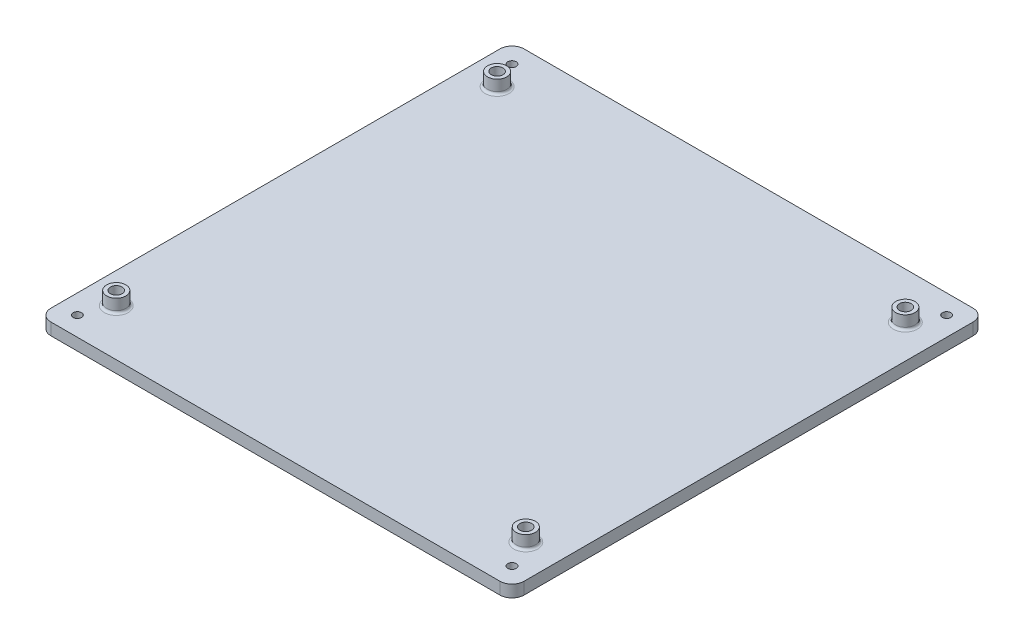
from build123d import *

# Parameters (mm, degrees)
SKETCH1_W           = 197
SKETCH1_H           = 197
BOSS_EXTRUDE1_DEPTH = 5
SKETCH2_R           = 1.75
CUT_EXTRUDE1_DEPTH  = 5
FILLET1_R           = 5
SKETCH5_R           = 4
SKETCH5_R_2         = 2.45
BOSS_EXTRUDE2_DEPTH = 5.5
FILLET2_R           = 1
CUT_EXTRUDE2_DEPTH  = 3
CUT_EXTRUDE4_DEPTH  = 3


with BuildPart() as part:
    # Sketch1 → Boss-Extrude1 (new body)
    with BuildSketch(Plane(origin=(0, 0, 0), x_dir=(1, 0, 0), z_dir=(0, 1, 0))):
        Rectangle(SKETCH1_W, SKETCH1_H)
    extrude(amount=BOSS_EXTRUDE1_DEPTH)

    # Sketch2 → Cut-Extrude1 (cut)
    with BuildSketch(Plane(origin=(0, 0, 0), x_dir=(1, 0, 0), z_dir=(0, 1, 0))):
        with Locations(Location((-90.5, 90.5, 0), (0, 0, 270))):
            Circle(SKETCH2_R)
        with Locations(Location((90.5, 90.5, 0), (0, 0, 90))):
            Circle(SKETCH2_R)
        with Locations(Location((90.5, -90.5, 0), (0, 0, 270))):
            Circle(SKETCH2_R)
        with Locations(Location((-90.5, -90.5, 0), (0, 0, 90))):
            Circle(SKETCH2_R)
    extrude(amount=CUT_EXTRUDE1_DEPTH, mode=Mode.SUBTRACT)

    # Fillet1
    fillet1_edges = [part.edges().sort_by_distance(p)[0] for p in [
        (-98.5, 2.5, -98.5),
        (98.5, 2.5, -98.5),
        (98.5, 2.5, 98.5),
        (-98.5, 2.5, 98.5),
    ]]
    fillet(fillet1_edges, radius=FILLET1_R)

    # Sketch5 → Boss-Extrude2 (add)
    # profile 1 of 4: a face of its own
    with BuildSketch(Plane(origin=(0, 5, 0), x_dir=(1, 0, 0), z_dir=(0, 1, 0))):
        with Locations(Location((84.5, 79.3, 0), (0, 0, 270))):
            Circle(SKETCH5_R)
        with Locations(Location((84.5, 79.3, 0), (0, 0, 270))):
            Circle(SKETCH5_R_2, mode=Mode.SUBTRACT)
    # profile 2 of 4: a face of its own
    with BuildSketch(Plane(origin=(0, 5, 0), x_dir=(1, 0, 0), z_dir=(0, 1, 0))):
        with Locations(Location((84.75, -79, 0), (0, 0, 270))):
            Circle(SKETCH5_R)
        with Locations(Location((84.75, -79, 0), (0, 0, 270))):
            Circle(SKETCH5_R_2, mode=Mode.SUBTRACT)
    # profile 3 of 4: a face of its own
    with BuildSketch(Plane(origin=(0, 5, 0), x_dir=(1, 0, 0), z_dir=(0, 1, 0))):
        with Locations(Location((-85.8, -79, 0), (0, 0, 270))):
            Circle(SKETCH5_R)
        with Locations(Location((-85.8, -79, 0), (0, 0, 270))):
            Circle(SKETCH5_R_2, mode=Mode.SUBTRACT)
    # profile 4 of 4: a face of its own
    with BuildSketch(Plane(origin=(0, 5, 0), x_dir=(1, 0, 0), z_dir=(0, 1, 0))):
        with Locations(Location((-85.5, 79.3, 0), (0, 0, 270))):
            Circle(SKETCH5_R)
        with Locations(Location((-85.5, 79.3, 0), (0, 0, 270))):
            Circle(SKETCH5_R_2, mode=Mode.SUBTRACT)
    extrude(amount=BOSS_EXTRUDE2_DEPTH)

    # Fillet2
    fillet2_edges = [part.edges().sort_by_distance(p)[0] for p in [
        (84.5, 5, -83.3),
        (84.75, 5, 75),
        (-85.8, 5, 75),
        (-85.5, 5, -83.3),
    ]]
    fillet(fillet2_edges, radius=FILLET2_R)

    # Sketch6 → Cut-Extrude2 (cut)
    # profile 1 of 14: a face of its own
    with BuildSketch(Plane(origin=(0, 0, 0), x_dir=(1, 0, 0), z_dir=(0, 1, 0))):
        with BuildLine():
            Line((69.398642149, 13.074504186), (67.395437021, 13.074504186))
            add(Edge.make_bspline(
                [(67.395437021, 13.074504186), (67.264550196, 13.073918309), (67.012042076, 13.072788029), (66.647904593, 13.059081879), (66.311969935, 13.034519624), (66.004315284, 13.004164562), (65.725067139, 12.961607945), (65.473875798, 12.912820116), (65.250689132, 12.853382341), (65.05299038, 12.782830525), (64.875562137, 12.699652691), (64.707657792, 12.611062361), (64.553072004, 12.505332926), (64.40400236, 12.393859456), (64.268971428, 12.265992934), (64.139555172, 12.130243061), (64.021234722, 11.98122611), (63.913461826, 11.820745891), (63.815695203, 11.651767392), (63.73027974, 11.473988529), (63.6609955, 11.287127986), (63.602874638, 11.092394539), (63.556191395, 10.889796674), (63.525117543, 10.678088396), (63.504010619, 10.458747933), (63.502148224, 10.309464676), (63.501206251, 10.233959314)],
                knots=[0, 0, 0, 0, 1.698747864, 3.27724071, 4.728299578, 6.070144658, 7.288476769, 8.393259625, 9.389771311, 10.283485332, 11.113357557, 11.931608583, 12.74405601, 13.541433047, 14.344816069, 15.154114104, 15.974336324, 16.810834471, 17.661136416, 18.50621059, 19.367396281, 20.244825668, 21.142564693, 22.063065223, 23.020325768, 24, 24, 24, 24], degree=3))
            add(Edge.make_bspline(
                [(63.501206251, 10.233959314), (63.502569168, 10.150429531), (63.505247467, 9.986283241), (63.531503428, 9.745664919), (63.576356905, 9.516257135), (63.634978053, 9.29612525), (63.716721074, 9.088890924), (63.810108638, 8.88960948), (63.925004964, 8.70386816), (64.056292383, 8.529343563), (64.199673223, 8.364616721), (64.358551339, 8.21444381), (64.529898444, 8.077801108), (64.712722673, 7.953256588), (64.907710403, 7.841061483), (65.114720939, 7.740165207), (65.335167867, 7.653794734), (65.488680476, 7.608623676), (65.566510738, 7.585722135)],
                knots=[0, 0, 0, 0, 1.102006807, 2.165578795, 3.188629044, 4.184801286, 5.166646146, 6.124351954, 7.085497154, 8.042432466, 9.003981491, 9.963833307, 10.922997304, 11.89326795, 12.880200226, 13.889073926, 14.929769137, 16, 16, 16, 16], degree=3))
            add(Edge.make_bspline(
                [(65.566510738, 7.585722135), (65.617774227, 7.572967696), (65.72882745, 7.545337474), (65.912590033, 7.517285864), (66.124357115, 7.491494134), (66.364813478, 7.469329264), (66.634097752, 7.454262317), (66.931949197, 7.442495701), (67.258502797, 7.433940156), (67.485575257, 7.433636568), (67.603770354, 7.433478545)],
                knots=[0, 0, 0, 0, 0.618981996, 1.340914327, 2.176866532, 3.120127938, 4.170906482, 5.338178032, 6.614476169, 8, 8, 8, 8], degree=3))
            Line((67.603770354, 7.433478545), (67.603770354, 3.074504186))
            Line((67.603770354, 3.074504186), (69.398642149, 3.074504186))
            Line((69.398642149, 3.074504186), (69.398642149, 13.074504186))
        make_face()
        with BuildLine():
            Line((67.603770354, 9.22835034), (66.968754328, 9.22835034))
            add(Edge.make_bspline(
                [(66.968754328, 9.22835034), (66.853203137, 9.229083024), (66.640587228, 9.230431174), (66.350228979, 9.249926205), (66.116891504, 9.279699055), (65.932550566, 9.322400208), (65.786995935, 9.387204861), (65.661464179, 9.462171642), (65.553792387, 9.556965077), (65.460564462, 9.665282798), (65.386031547, 9.789745287), (65.334346851, 9.928325915), (65.30077349, 10.078112956), (65.297672678, 10.182354822), (65.296078046, 10.23596252)],
                knots=[0, 0, 0, 0, 1.8619151, 3.425951444, 4.686033666, 5.651700536, 6.461346321, 7.243864085, 7.999046032, 8.762387399, 9.539336099, 10.322741239, 11.137448474, 12, 12, 12, 12], degree=3))
            add(Edge.make_bspline(
                [(65.296078046, 10.23596252), (65.297656275, 10.282798867), (65.300718418, 10.373672642), (65.323213755, 10.504826039), (65.359064852, 10.627088061), (65.411011713, 10.739181843), (65.478166704, 10.84091692), (65.560042227, 10.932253213), (65.65558766, 11.015146769), (65.72935432, 11.059023594), (65.766831251, 11.081315084)],
                knots=[0, 0, 0, 0, 1.102301479, 2.1387299, 3.123554645, 4.094223062, 5.036071848, 5.982632524, 6.975082478, 8, 8, 8, 8], degree=3))
            add(Edge.make_bspline(
                [(65.766831251, 11.081315084), (65.798576376, 11.097369503), (65.865787309, 11.13136), (65.980254045, 11.170876437), (66.11234691, 11.204212905), (66.26295768, 11.231881851), (66.431485525, 11.253355827), (66.617900378, 11.269778047), (66.822476565, 11.276382061), (66.964747062, 11.278519065), (67.038866508, 11.279632391)],
                knots=[0, 0, 0, 0, 0.656809284, 1.390599849, 2.23162475, 3.173112763, 4.218524733, 5.370385145, 6.63003504, 8, 8, 8, 8], degree=3))
            Line((67.038866508, 11.279632391), (67.603770354, 11.279632391))
            Line((67.603770354, 11.279632391), (67.603770354, 9.22835034))
        make_face(mode=Mode.SUBTRACT)
    # profile 2 of 14: a face of its own
    with BuildSketch(Plane(origin=(0, 0, 0), x_dir=(1, 0, 0), z_dir=(0, 1, 0))):
        with BuildLine():
            add(Edge.make_bspline(
                [(57.006815226, 13.330914443), (56.83295297, 13.326412838), (56.489709498, 13.317525649), (55.984922215, 13.243444), (55.498466333, 13.122738573), (55.030561826, 12.954949299), (54.582380273, 12.735531591), (54.152340788, 12.470706086), (53.741983751, 12.155474361), (53.355514173, 11.797190252), (52.998346581, 11.407571928), (52.688860655, 10.988078533), (52.42494241, 10.549579563), (52.206206263, 10.090900047), (52.039597974, 9.608863411), (51.922682046, 9.105927404), (51.847569354, 8.582235107), (51.838930239, 8.225672033), (51.834539585, 8.044456109)],
                knots=[0, 0, 0, 0, 1.014329547, 2.002516266, 2.970391464, 3.935626869, 4.897733899, 5.877609409, 6.878433252, 7.912639331, 8.949961323, 9.958554974, 10.949718813, 11.932905612, 12.9188844, 13.919928257, 14.942845884, 16, 16, 16, 16], degree=3))
            add(Edge.make_bspline(
                [(51.834539585, 8.044456109), (51.839215442, 7.865282071), (51.848429368, 7.512213879), (51.919615617, 6.993347613), (52.038500424, 6.495799099), (52.202282906, 6.018442124), (52.417052006, 5.563588841), (52.675823557, 5.128335077), (52.985426049, 4.71672009), (53.334567062, 4.328964768), (53.718941018, 3.97699361), (54.126054055, 3.666819635), (54.554026378, 3.403989913), (55.002231572, 3.188624834), (55.47163079, 3.021487928), (55.961064561, 2.903560696), (56.470502597, 2.831893936), (56.816945166, 2.822740194), (56.99279279, 2.81809393)],
                knots=[0, 0, 0, 0, 1.051557043, 2.072126891, 3.067553643, 4.050577992, 5.02905126, 6.015227836, 7.017913613, 8.04756643, 9.074058332, 10.072836633, 11.047628519, 12.017157415, 12.98668631, 13.966869689, 14.968021931, 16, 16, 16, 16], degree=3))
            add(Edge.make_bspline(
                [(56.99279279, 2.81809393), (57.176708319, 2.822261858), (57.538077195, 2.830451267), (58.066942163, 2.908328808), (58.5736405, 3.025639589), (59.053915649, 3.200719637), (59.5126588, 3.419584419), (59.946499435, 3.689129519), (60.355291752, 4.008909494), (60.736690854, 4.37073466), (61.082239364, 4.766650752), (61.387253703, 5.184900993), (61.644540065, 5.622290321), (61.854107862, 6.079023441), (62.019322695, 6.552261869), (62.135862988, 7.044887764), (62.20470612, 7.55571963), (62.214295568, 7.902686845), (62.219154969, 8.078510597)],
                knots=[0, 0, 0, 0, 1.067978421, 2.098431617, 3.099715153, 4.085208694, 5.062210972, 6.048429807, 7.046490867, 8.072918869, 9.098532598, 10.095778865, 11.076610158, 12.041847152, 13.011192615, 13.984257998, 14.978533688, 16, 16, 16, 16], degree=3))
            add(Edge.make_bspline(
                [(62.219154969, 8.078510597), (62.217629809, 8.196795612), (62.214598801, 8.431867884), (62.178087118, 8.780232992), (62.125520792, 9.12179848), (62.04777769, 9.455202523), (61.953339691, 9.78279713), (61.830981923, 10.101532971), (61.69170567, 10.414815019), (61.528974482, 10.718943023), (61.348033136, 11.01111875), (61.150610018, 11.289963956), (60.936208709, 11.552106996), (60.705519868, 11.799270565), (60.45774851, 12.029830039), (60.196153811, 12.247049308), (59.915662357, 12.445158257), (59.622413226, 12.628995101), (59.318059688, 12.795235571), (59.00384074, 12.936734487), (58.686229912, 13.06030308), (58.360984352, 13.157828878), (58.031589644, 13.237262619), (57.694526873, 13.289793516), (57.35284121, 13.326304188), (57.12243095, 13.329374044), (57.006815226, 13.330914443)],
                knots=[0, 0, 0, 0, 1.034744296, 2.056386356, 3.06226378, 4.057406941, 5.050368692, 6.043467995, 7.042652155, 8.049140477, 9.059438543, 10.048523776, 11.036952808, 12.020949711, 13.004946614, 13.997082645, 14.994316842, 16.007702937, 17.024872941, 18.026463647, 19.021641123, 20.005082605, 20.995858141, 21.984425357, 22.988620895, 24, 24, 24, 24], degree=3))
        make_face()
        with BuildLine():
            add(Edge.make_bspline(
                [(57.034860097, 11.536042648), (57.151869373, 11.532903026), (57.382798859, 11.52670667), (57.721530359, 11.479498813), (58.046724561, 11.4041025), (58.356578786, 11.294891862), (58.652435968, 11.155894438), (58.934820571, 10.987595901), (59.199822151, 10.784211178), (59.450974249, 10.556659087), (59.677848841, 10.303113764), (59.878299701, 10.031396829), (60.046044785, 9.741962047), (60.186532343, 9.437498198), (60.292288338, 9.114581666), (60.367615162, 8.775741893), (60.415218904, 8.420395038), (60.421219414, 8.178155551), (60.424283174, 8.054472135)],
                knots=[0, 0, 0, 0, 1.033739768, 2.040188636, 3.016340934, 3.979330865, 4.937572243, 5.900995986, 6.878200029, 7.884839167, 8.891893314, 9.879764717, 10.863503415, 11.843163062, 12.837761627, 13.859916423, 14.907309254, 16, 16, 16, 16], degree=3))
            add(Edge.make_bspline(
                [(60.424283174, 8.054472135), (60.420221096, 7.917403088), (60.412260096, 7.648770468), (60.356245533, 7.256896439), (60.26041019, 6.886810312), (60.122025818, 6.540322123), (59.950392891, 6.21358438), (59.737252036, 5.910601719), (59.486055125, 5.629560021), (59.29253506, 5.465476171), (59.194315226, 5.382196494)],
                knots=[0, 0, 0, 0, 1.078454662, 2.113592447, 3.107694534, 4.079536787, 5.043276885, 6.005368276, 6.987637804, 8, 8, 8, 8], degree=3))
            add(Edge.make_bspline(
                [(59.194315226, 5.382196494), (59.11385443, 5.320672667), (58.954745634, 5.199011155), (58.700773354, 5.04307697), (58.439231916, 4.909425817), (58.168147661, 4.801437267), (57.888093104, 4.716495289), (57.599106651, 4.657011818), (57.301597771, 4.619680796), (57.100408323, 4.615219032), (56.998802405, 4.612965725)],
                knots=[0, 0, 0, 0, 1.023928204, 2.024787132, 3.009472467, 3.9914905, 4.972207045, 5.96565515, 6.972602802, 8, 8, 8, 8], degree=3))
            add(Edge.make_bspline(
                [(56.998802405, 4.612965725), (56.883805107, 4.616131967), (56.657544308, 4.622361648), (56.325118477, 4.66898835), (56.006644435, 4.747897564), (55.700145068, 4.856150167), (55.406504182, 4.996892825), (55.127156881, 5.170411454), (54.861613393, 5.37457547), (54.610781259, 5.605115818), (54.381508832, 5.859659935), (54.181476272, 6.13282618), (54.008397733, 6.418595882), (53.870831616, 6.721013677), (53.76089744, 7.037224885), (53.686477213, 7.368629936), (53.638471329, 7.713862652), (53.632469127, 7.948805716), (53.62941138, 8.068494571)],
                knots=[0, 0, 0, 0, 1.026359118, 2.019393844, 2.989460624, 3.950973911, 4.916101784, 5.890408035, 6.881132271, 7.902007068, 8.92769091, 9.933912415, 10.920395702, 11.90457117, 12.894218921, 13.903490204, 14.931958862, 16, 16, 16, 16], degree=3))
            add(Edge.make_bspline(
                [(53.62941138, 8.068494571), (53.632574926, 8.187495182), (53.638801884, 8.421729736), (53.685510652, 8.766074862), (53.763919444, 9.096016856), (53.872497119, 9.41209455), (54.01114506, 9.714617817), (54.182597304, 10.002522806), (54.386252248, 10.275531183), (54.617422784, 10.531782501), (54.869037704, 10.767261047), (55.139171463, 10.97161362), (55.420265413, 11.149189509), (55.718769222, 11.28829529), (56.028575752, 11.39912057), (56.351575458, 11.480733897), (56.688991722, 11.526375032), (56.918542983, 11.532791384), (57.034860097, 11.536042648)],
                knots=[0, 0, 0, 0, 1.055025985, 2.07665775, 3.074803781, 4.057872707, 5.035505728, 6.020516407, 7.023567878, 8.050795229, 9.077271434, 10.074415901, 11.050397877, 12.019801805, 12.988065821, 13.964604439, 14.968634123, 16, 16, 16, 16], degree=3))
        make_face(mode=Mode.SUBTRACT)
    # profile 3 of 14: a face of its own
    with BuildSketch(Plane(origin=(0, 0, 0), x_dir=(1, 0, 0), z_dir=(0, 1, 0))):
        Polygon((50.03966779, 13.074504186), (48.244795995, 13.074504186), (48.244795995, 4.869375981), (45.424283174, 4.869375981), (45.424283174, 3.074504186), (50.03966779, 3.074504186), align=None)
    # profile 4 of 14: a face of its own
    with BuildSketch(Plane(origin=(0, 0, 0), x_dir=(1, 0, 0), z_dir=(0, 1, 0))):
        Polygon((43.09455561, 13.074504186), (41.231574841, 13.074504186), (38.9499242, 6.09934393), (36.652247918, 13.074504186), (34.807295995, 13.074504186), (33.116590867, 3.074504186), (34.933497918, 3.074504186), (36.001206251, 9.390609955), (38.080533174, 3.074504186), (39.831334456, 3.074504186), (41.898642149, 9.390609955), (42.964347277, 3.074504186), (44.783257533, 3.074504186), align=None)
    # profile 5 of 14: a face of its own
    with BuildSketch(Plane(origin=(0, 0, 0), x_dir=(1, 0, 0), z_dir=(0, 1, 0))):
        Polygon((28.370997918, 13.074504186), (26.706334456, 13.074504186), (22.667872918, 3.074504186), (24.584940226, 3.074504186), (25.362183815, 5.125786238), (29.719154969, 5.125786238), (30.496398559, 3.074504186), (32.411462662, 3.074504186), align=None)
        Polygon((27.53966779, 10.39221252), (29.038065226, 6.920658032), (26.041270354, 6.920658032), align=None, mode=Mode.SUBTRACT)
    # profile 6 of 14: a face of its own
    with BuildSketch(Plane(origin=(0, 0, 0), x_dir=(1, 0, 0), z_dir=(0, 1, 0))):
        Polygon((21.193513944, 13.074504186), (19.576927405, 13.074504186), (15.03966779, 6.49397534), (15.03966779, 13.074504186), (13.244795995, 13.074504186), (13.244795995, 3.074504186), (14.873401764, 3.074504186), (19.398642149, 9.635000981), (19.398642149, 3.074504186), (21.193513944, 3.074504186), align=None)
    # profile 7 of 14: a face of its own
    with BuildSketch(Plane(origin=(0, 0, 0), x_dir=(1, 0, 0), z_dir=(0, 1, 0))):
        Polygon((7.701927405, 13.074504186), (5.58654279, 13.074504186), (3.497199841, 9.863366366), (1.403850482, 13.074504186), (-0.713537338, 13.074504186), (2.439507533, 8.238767007), (-0.921870672, 3.074504186), (1.193513944, 3.074504186), (3.497199841, 6.616170853), (5.806895354, 3.074504186), (7.924283174, 3.074504186), (4.554892149, 8.240770212), align=None)
    # profile 8 of 14: a face of its own
    with BuildSketch(Plane(origin=(0, 0, 0), x_dir=(1, 0, 0), z_dir=(0, 1, 0))):
        with BuildLine():
            Line((-15.278841826, 11.483959314), (-13.920668749, 10.183879186))
            add(Edge.make_bspline(
                [(-13.920668749, 10.183879186), (-13.813139816, 10.291536957), (-13.602150299, 10.502779278), (-13.257103336, 10.777725675), (-12.899739401, 11.011484468), (-12.528882267, 11.203697298), (-12.144015326, 11.35279428), (-11.745898086, 11.459448122), (-11.333882862, 11.522706323), (-11.054966946, 11.531562256), (-10.913857851, 11.536042648)],
                knots=[0, 0, 0, 0, 1.075575784, 2.110457258, 3.113929901, 4.09197124, 5.059417775, 6.02750972, 7.002078037, 8, 8, 8, 8], degree=3))
            add(Edge.make_bspline(
                [(-10.913857851, 11.536042648), (-10.79152058, 11.532903257), (-10.551300624, 11.526738789), (-10.198320535, 11.479926239), (-9.861026438, 11.401727979), (-9.537824816, 11.293397346), (-9.230688927, 11.152424955), (-8.937839169, 10.980986547), (-8.661077742, 10.777770606), (-8.402583942, 10.546629399), (-8.167224505, 10.294269869), (-7.961743289, 10.024155935), (-7.786717437, 9.741322294), (-7.642635465, 9.444321925), (-7.533004753, 9.133610666), (-7.45474277, 8.809414078), (-7.405065872, 8.472674319), (-7.399200515, 8.242946968), (-7.396229646, 8.12658752)],
                knots=[0, 0, 0, 0, 1.075001177, 2.110859044, 3.123021556, 4.114053297, 5.101481495, 6.087880186, 7.091499647, 8.114004866, 9.131394192, 10.11971144, 11.092043119, 12.050101265, 13.015322563, 13.981809771, 14.977764287, 16, 16, 16, 16], degree=3))
            add(Edge.make_bspline(
                [(-7.396229646, 8.12658752), (-7.39900073, 8.006200714), (-7.404460145, 7.769022227), (-7.456904, 7.420952602), (-7.537702787, 7.08608454), (-7.655970667, 6.766902685), (-7.80152261, 6.459034692), (-7.986106455, 6.168444257), (-8.20134969, 5.890693744), (-8.446867705, 5.63061895), (-8.713927901, 5.39089258), (-9.003162783, 5.184098443), (-9.305772052, 5.005679741), (-9.626639835, 4.864377896), (-9.960196818, 4.750927994), (-10.309826226, 4.670936078), (-10.674740778, 4.621861314), (-10.923718687, 4.615960439), (-11.0500758, 4.612965725)],
                knots=[0, 0, 0, 0, 1.022067601, 2.013613092, 2.983553406, 3.943623673, 4.90013463, 5.87121881, 6.861774014, 7.881098904, 8.905697761, 9.905387765, 10.89678721, 11.884561068, 12.87834324, 13.885584958, 14.926927371, 16, 16, 16, 16], degree=3))
            add(Edge.make_bspline(
                [(-11.0500758, 4.612965725), (-11.132266422, 4.613707316), (-11.293624902, 4.615163226), (-11.530310295, 4.638796734), (-11.756998051, 4.672583581), (-11.974566071, 4.717313355), (-12.1808175, 4.780614011), (-12.378608032, 4.854636333), (-12.566778788, 4.941997433), (-12.744309526, 5.045711431), (-12.913842417, 5.161962145), (-13.073790602, 5.294977682), (-13.22695976, 5.441759033), (-13.371560128, 5.604099338), (-13.505144303, 5.783450112), (-13.631991985, 5.976515546), (-13.750650787, 6.185211695), (-13.820763142, 6.332582345), (-13.856566185, 6.40783752)],
                knots=[0, 0, 0, 0, 1.109579412, 2.178351274, 3.208885622, 4.204702371, 5.174744997, 6.119429583, 7.05542196, 7.97267548, 8.893247984, 9.828544973, 10.778894627, 11.756245826, 12.760884819, 13.796418446, 14.874735809, 16, 16, 16, 16], degree=3))
            Line((-13.856566185, 6.40783752), (-10.985973236, 6.40783752))
            Line((-10.985973236, 6.40783752), (-10.985973236, 8.202709314))
            Line((-10.985973236, 8.202709314), (-15.9719508, 8.202709314))
            Line((-15.9719508, 8.202709314), (-15.985973236, 7.776026622))
            add(Edge.make_bspline(
                [(-15.985973236, 7.776026622), (-15.984171457, 7.666443681), (-15.980571115, 7.447473358), (-15.947667767, 7.12146385), (-15.893163871, 6.799778183), (-15.818651828, 6.482739448), (-15.725269389, 6.168792458), (-15.606177547, 5.860943517), (-15.466721729, 5.557104894), (-15.310471378, 5.25856767), (-15.134890941, 4.972113085), (-14.945852819, 4.700878409), (-14.74605188, 4.445333088), (-14.531142535, 4.20903751), (-14.304471278, 3.990006686), (-14.065591902, 3.789083256), (-13.813659505, 3.606097213), (-13.550008672, 3.439502743), (-13.273137658, 3.29349252), (-12.9845687, 3.166482995), (-12.684737496, 3.058616488), (-12.372869954, 2.970189417), (-12.04957975, 2.901960897), (-11.714859959, 2.855176511), (-11.36852675, 2.823385996), (-11.13361626, 2.819879278), (-11.014018108, 2.81809393)],
                knots=[0, 0, 0, 0, 1.006889344, 2.011981806, 3.007738725, 4.003571281, 5.003404394, 6.015442001, 7.03424805, 8.074616296, 9.110249922, 10.119753985, 11.111721717, 12.089233633, 13.052717867, 14.006597561, 14.955430184, 15.912305663, 16.870361111, 17.829300583, 18.807640451, 19.796414044, 20.806216501, 21.841577364, 22.90109906, 24, 24, 24, 24], degree=3))
            add(Edge.make_bspline(
                [(-11.014018108, 2.81809393), (-10.886414988, 2.819856994), (-10.633467546, 2.823351913), (-10.259450852, 2.85608421), (-9.896284615, 2.910106752), (-9.543878253, 2.984872105), (-9.201413549, 3.077923559), (-8.869478911, 3.194725145), (-8.548753234, 3.333664325), (-8.238276095, 3.491061937), (-7.942015732, 3.669564538), (-7.660636109, 3.866042066), (-7.395673052, 4.081758369), (-7.144412517, 4.313102311), (-6.912724921, 4.565760348), (-6.691976173, 4.831542607), (-6.492860794, 5.12019692), (-6.306817414, 5.422365032), (-6.141534989, 5.737920316), (-5.996993132, 6.061026415), (-5.873727919, 6.389812544), (-5.776530318, 6.725809641), (-5.69761497, 7.066674852), (-5.641149557, 7.413890522), (-5.6092609, 7.767413187), (-5.604003896, 8.00499873), (-5.601357851, 8.124584314)],
                knots=[0, 0, 0, 0, 1.084149091, 2.14910686, 3.187506334, 4.202448172, 5.208724393, 6.201130722, 7.189831603, 8.176984443, 9.156919086, 10.126598231, 11.090766514, 12.05840148, 13.026036446, 14.001772938, 14.991905635, 16.003017641, 17.015720547, 18.016462227, 19.009322657, 19.99686681, 20.986544154, 21.980959929, 22.983742515, 24, 24, 24, 24], degree=3))
            add(Edge.make_bspline(
                [(-5.601357851, 8.124584314), (-5.60490147, 8.287724606), (-5.611899066, 8.609878315), (-5.676707423, 9.084412772), (-5.777733997, 9.54347751), (-5.922717302, 9.985400647), (-6.10876512, 10.410790937), (-6.333241913, 10.820647004), (-6.601023806, 11.214533207), (-6.808305383, 11.458403471), (-6.91345721, 11.582116366)],
                knots=[0, 0, 0, 0, 1.034044851, 2.041932006, 3.031217818, 4.011390712, 4.986069675, 5.97149666, 6.970960976, 8, 8, 8, 8], degree=3))
            add(Edge.make_bspline(
                [(-6.91345721, 11.582116366), (-6.978744952, 11.653688025), (-7.108340138, 11.795756692), (-7.315497806, 11.993163995), (-7.527909051, 12.178734163), (-7.748515802, 12.348532297), (-7.976158371, 12.50627536), (-8.211491952, 12.649006332), (-8.45328204, 12.781269843), (-8.703414305, 12.896312018), (-8.96057927, 12.999456923), (-9.225915878, 13.086732016), (-9.497436813, 13.164037005), (-9.777546401, 13.222846274), (-10.063414867, 13.271818145), (-10.357071402, 13.304641658), (-10.657715774, 13.328698956), (-10.861056506, 13.330170106), (-10.963937979, 13.330914443)],
                knots=[0, 0, 0, 0, 1.020590567, 2.025856924, 3.013483481, 3.991664875, 4.957826714, 5.930500614, 6.890802512, 7.860442893, 8.829981142, 9.809047939, 10.802672283, 11.803273349, 12.823572789, 13.857849586, 14.916166035, 16, 16, 16, 16], degree=3))
            add(Edge.make_bspline(
                [(-10.963937979, 13.330914443), (-11.071482522, 13.329255921), (-11.285456671, 13.325956071), (-11.603600797, 13.303123267), (-11.917324097, 13.267897631), (-12.225304511, 13.215057166), (-12.528575621, 13.149893875), (-12.825567625, 13.066403571), (-13.118218028, 12.971543546), (-13.308732331, 12.895914126), (-13.403841826, 12.858158032)],
                knots=[0, 0, 0, 0, 1.03180557, 2.052914215, 3.058998889, 4.059601663, 5.049854447, 6.033765722, 7.018406786, 8, 8, 8, 8], degree=3))
            add(Edge.make_bspline(
                [(-13.403841826, 12.858158032), (-13.4838647, 12.823264606), (-13.646629012, 12.752292342), (-13.883431026, 12.622445256), (-14.120811612, 12.478494858), (-14.356209313, 12.315177988), (-14.589265449, 12.132800124), (-14.822413374, 11.934241893), (-15.05327303, 11.717187994), (-15.202678469, 11.562709033), (-15.278841826, 11.483959314)],
                knots=[0, 0, 0, 0, 0.894392155, 1.819168899, 2.76525314, 3.739198753, 4.75366411, 5.797420238, 6.877176959, 8, 8, 8, 8], degree=3))
        make_face()
    # profile 9 of 14: a face of its own
    with BuildSketch(Plane(origin=(0, 0, 0), x_dir=(1, 0, 0), z_dir=(0, 1, 0))):
        Polygon((-17.780845031, 13.074504186), (-23.165460415, 13.074504186), (-23.165460415, 11.279632391), (-19.575716826, 11.279632391), (-19.575716826, 9.356555468), (-23.165460415, 9.356555468), (-23.165460415, 7.561683673), (-19.575716826, 7.561683673), (-19.575716826, 4.869375981), (-23.165460415, 4.869375981), (-23.165460415, 3.074504186), (-17.780845031, 3.074504186), align=None)
    # profile 10 of 14: a face of its own
    with BuildSketch(Plane(origin=(0, 0, 0), x_dir=(1, 0, 0), z_dir=(0, 1, 0))):
        with BuildLine():
            add(Edge.make_bspline(
                [(-29.659851441, 13.330914443), (-29.833713697, 13.326412838), (-30.176957168, 13.317525649), (-30.681744451, 13.243444), (-31.168200333, 13.122738573), (-31.636104841, 12.954949299), (-32.084286394, 12.735531591), (-32.514325879, 12.470706086), (-32.924682916, 12.155474361), (-33.311152494, 11.797190252), (-33.668320085, 11.407571928), (-33.977806012, 10.988078533), (-34.241724256, 10.549579563), (-34.460460403, 10.090900047), (-34.627068693, 9.608863411), (-34.743984621, 9.105927404), (-34.819097312, 8.582235107), (-34.827736428, 8.225672033), (-34.832127082, 8.044456109)],
                knots=[0, 0, 0, 0, 1.014329547, 2.002516266, 2.970391464, 3.935626869, 4.897733899, 5.877609409, 6.878433252, 7.912639331, 8.949961323, 9.958554974, 10.949718813, 11.932905612, 12.9188844, 13.919928257, 14.942845884, 16, 16, 16, 16], degree=3))
            add(Edge.make_bspline(
                [(-34.832127082, 8.044456109), (-34.827451225, 7.865282071), (-34.818237299, 7.512213879), (-34.74705105, 6.993347613), (-34.628166243, 6.495799099), (-34.464383761, 6.018442124), (-34.24961466, 5.563588841), (-33.990843109, 5.128335077), (-33.681240618, 4.71672009), (-33.332099605, 4.328964768), (-32.947725649, 3.97699361), (-32.540612612, 3.666819635), (-32.112640289, 3.403989913), (-31.664435095, 3.188624834), (-31.195035876, 3.021487928), (-30.705602106, 2.903560696), (-30.19616407, 2.831893936), (-29.849721501, 2.822740194), (-29.673873877, 2.81809393)],
                knots=[0, 0, 0, 0, 1.051557043, 2.072126891, 3.067553643, 4.050577992, 5.02905126, 6.015227836, 7.017913613, 8.04756643, 9.074058332, 10.072836633, 11.047628519, 12.017157415, 12.98668631, 13.966869689, 14.968021931, 16, 16, 16, 16], degree=3))
            add(Edge.make_bspline(
                [(-29.673873877, 2.81809393), (-29.489958348, 2.822261858), (-29.128589471, 2.830451267), (-28.599724503, 2.908328808), (-28.093026166, 3.025639589), (-27.612751018, 3.200719637), (-27.154007866, 3.419584419), (-26.720167232, 3.689129519), (-26.311374914, 4.008909494), (-25.929975813, 4.37073466), (-25.584427303, 4.766650752), (-25.279412963, 5.184900993), (-25.022126602, 5.622290321), (-24.812558805, 6.079023441), (-24.647343972, 6.552261869), (-24.530803679, 7.044887764), (-24.461960547, 7.55571963), (-24.452371098, 7.902686845), (-24.447511697, 8.078510597)],
                knots=[0, 0, 0, 0, 1.067978421, 2.098431617, 3.099715153, 4.085208694, 5.062210972, 6.048429807, 7.046490867, 8.072918869, 9.098532598, 10.095778865, 11.076610158, 12.041847152, 13.011192615, 13.984257998, 14.978533688, 16, 16, 16, 16], degree=3))
            add(Edge.make_bspline(
                [(-24.447511697, 8.078510597), (-24.449036857, 8.196795612), (-24.452067865, 8.431867884), (-24.488579548, 8.780232992), (-24.541145875, 9.12179848), (-24.618888977, 9.455202523), (-24.713326976, 9.78279713), (-24.835684743, 10.101532971), (-24.974960996, 10.414815019), (-25.137692184, 10.718943023), (-25.318633531, 11.01111875), (-25.516056649, 11.289963956), (-25.730457958, 11.552106996), (-25.961146798, 11.799270565), (-26.208918156, 12.029830039), (-26.470512856, 12.247049308), (-26.75100431, 12.445158257), (-27.044253441, 12.628995101), (-27.348606978, 12.795235571), (-27.662825926, 12.936734487), (-27.980436755, 13.06030308), (-28.305682315, 13.157828878), (-28.635077023, 13.237262619), (-28.972139793, 13.289793516), (-29.313825456, 13.326304188), (-29.544235716, 13.329374044), (-29.659851441, 13.330914443)],
                knots=[0, 0, 0, 0, 1.034744296, 2.056386356, 3.06226378, 4.057406941, 5.050368692, 6.043467995, 7.042652155, 8.049140477, 9.059438543, 10.048523776, 11.036952808, 12.020949711, 13.004946614, 13.997082645, 14.994316842, 16.007702937, 17.024872941, 18.026463647, 19.021641123, 20.005082605, 20.995858141, 21.984425357, 22.988620895, 24, 24, 24, 24], degree=3))
        make_face()
        with BuildLine():
            add(Edge.make_bspline(
                [(-29.631806569, 11.536042648), (-29.514797294, 11.532903026), (-29.283867808, 11.52670667), (-28.945136308, 11.479498813), (-28.619942106, 11.4041025), (-28.310087881, 11.294891862), (-28.014230699, 11.155894438), (-27.731846096, 10.987595901), (-27.466844516, 10.784211178), (-27.215692418, 10.556659087), (-26.988817825, 10.303113764), (-26.788366965, 10.031396829), (-26.620621882, 9.741962047), (-26.480134324, 9.437498198), (-26.374378329, 9.114581666), (-26.299051504, 8.775741893), (-26.251447763, 8.420395038), (-26.245447252, 8.178155551), (-26.242383492, 8.054472135)],
                knots=[0, 0, 0, 0, 1.033739768, 2.040188636, 3.016340934, 3.979330865, 4.937572243, 5.900995986, 6.878200029, 7.884839167, 8.891893314, 9.879764717, 10.863503415, 11.843163062, 12.837761627, 13.859916423, 14.907309254, 16, 16, 16, 16], degree=3))
            add(Edge.make_bspline(
                [(-26.242383492, 8.054472135), (-26.24644557, 7.917403088), (-26.25440657, 7.648770468), (-26.310421134, 7.256896439), (-26.406256477, 6.886810312), (-26.544640849, 6.540322123), (-26.716273776, 6.21358438), (-26.929414631, 5.910601719), (-27.180611542, 5.629560021), (-27.374131606, 5.465476171), (-27.472351441, 5.382196494)],
                knots=[0, 0, 0, 0, 1.078454662, 2.113592447, 3.107694534, 4.079536787, 5.043276885, 6.005368276, 6.987637804, 8, 8, 8, 8], degree=3))
            add(Edge.make_bspline(
                [(-27.472351441, 5.382196494), (-27.552812237, 5.320672667), (-27.711921033, 5.199011155), (-27.965893312, 5.04307697), (-28.227434751, 4.909425817), (-28.498519006, 4.801437267), (-28.778573562, 4.716495289), (-29.067560015, 4.657011818), (-29.365068896, 4.619680796), (-29.566258344, 4.615219032), (-29.667864262, 4.612965725)],
                knots=[0, 0, 0, 0, 1.023928204, 2.024787132, 3.009472467, 3.9914905, 4.972207045, 5.96565515, 6.972602802, 8, 8, 8, 8], degree=3))
            add(Edge.make_bspline(
                [(-29.667864262, 4.612965725), (-29.782861559, 4.616131967), (-30.009122359, 4.622361648), (-30.341548189, 4.66898835), (-30.660022231, 4.747897564), (-30.966521599, 4.856150167), (-31.260162485, 4.996892825), (-31.539509786, 5.170411454), (-31.805053274, 5.37457547), (-32.055885407, 5.605115818), (-32.285157834, 5.859659935), (-32.485190395, 6.13282618), (-32.658268934, 6.418595882), (-32.795835051, 6.721013677), (-32.905769226, 7.037224885), (-32.980189453, 7.368629936), (-33.028195338, 7.713862652), (-33.034197539, 7.948805716), (-33.037255287, 8.068494571)],
                knots=[0, 0, 0, 0, 1.026359118, 2.019393844, 2.989460624, 3.950973911, 4.916101784, 5.890408035, 6.881132271, 7.902007068, 8.92769091, 9.933912415, 10.920395702, 11.90457117, 12.894218921, 13.903490204, 14.931958862, 16, 16, 16, 16], degree=3))
            add(Edge.make_bspline(
                [(-33.037255287, 8.068494571), (-33.034091741, 8.187495182), (-33.027864783, 8.421729736), (-32.981156015, 8.766074862), (-32.902747222, 9.096016856), (-32.794169548, 9.41209455), (-32.655521607, 9.714617817), (-32.484069362, 10.002522806), (-32.280414419, 10.275531183), (-32.049243883, 10.531782501), (-31.797628962, 10.767261047), (-31.527495204, 10.97161362), (-31.246401253, 11.149189509), (-30.947897444, 11.28829529), (-30.638090915, 11.39912057), (-30.315091208, 11.480733897), (-29.977674944, 11.526375032), (-29.748123683, 11.532791384), (-29.631806569, 11.536042648)],
                knots=[0, 0, 0, 0, 1.055025985, 2.07665775, 3.074803781, 4.057872707, 5.035505728, 6.020516407, 7.023567878, 8.050795229, 9.077271434, 10.074415901, 11.050397877, 12.019801805, 12.988065821, 13.964604439, 14.968634123, 16, 16, 16, 16], degree=3))
        make_face(mode=Mode.SUBTRACT)
    # profile 11 of 14: a face of its own
    with BuildSketch(Plane(origin=(0, 0, 0), x_dir=(1, 0, 0), z_dir=(0, 1, 0))):
        Polygon((-36.626998877, 13.074504186), (-38.421870672, 13.074504186), (-38.421870672, 4.869375981), (-41.242383492, 4.869375981), (-41.242383492, 3.074504186), (-36.626998877, 3.074504186), align=None)
    # profile 12 of 14: a face of its own
    with BuildSketch(Plane(origin=(0, 0, 0), x_dir=(1, 0, 0), z_dir=(0, 1, 0))):
        Polygon((-45.859771313, 13.074504186), (-47.524434774, 13.074504186), (-51.562896313, 3.074504186), (-49.645829005, 3.074504186), (-48.868585415, 5.125786238), (-44.511614262, 5.125786238), (-43.734370672, 3.074504186), (-41.819306569, 3.074504186), align=None)
        Polygon((-46.691101441, 10.39221252), (-45.192704005, 6.920658032), (-48.189498877, 6.920658032), align=None, mode=Mode.SUBTRACT)
    # profile 13 of 14: a face of its own
    with BuildSketch(Plane(origin=(0, 0, 0), x_dir=(1, 0, 0), z_dir=(0, 1, 0))):
        with BuildLine():
            Line((-53.037255287, 3.074504186), (-53.037255287, 13.074504186))
            Line((-53.037255287, 13.074504186), (-54.63981939, 13.074504186))
            add(Edge.make_bspline(
                [(-54.63981939, 13.074504186), (-54.752008897, 13.07451699), (-54.969093467, 13.074541765), (-55.282289848, 13.063543336), (-55.572753041, 13.049315636), (-55.83955868, 13.033398149), (-56.083160886, 13.005969138), (-56.303189223, 12.977061957), (-56.500083308, 12.942201678), (-56.621812222, 12.910930928), (-56.67908221, 12.89621893)],
                knots=[0, 0, 0, 0, 1.311965854, 2.538629056, 3.664479157, 4.713267157, 5.663616078, 6.530575999, 7.308677837, 8, 8, 8, 8], degree=3))
            add(Edge.make_bspline(
                [(-56.67908221, 12.89621893), (-56.75428352, 12.875467395), (-56.901852631, 12.834746221), (-57.113218692, 12.752508052), (-57.313728884, 12.661094495), (-57.50313839, 12.556808725), (-57.680284161, 12.438391718), (-57.844492982, 12.304903683), (-57.999306432, 12.161702823), (-58.139227437, 12.00479817), (-58.265692973, 11.83899934), (-58.375568849, 11.664349776), (-58.471036902, 11.483519983), (-58.547436351, 11.29423434), (-58.605001901, 11.097364558), (-58.647105103, 10.8937513), (-58.67439368, 10.682750286), (-58.676972093, 10.539199399), (-58.678280928, 10.466331109)],
                knots=[0, 0, 0, 0, 1.099996261, 2.158545794, 3.195537121, 4.207578794, 5.205712374, 6.197378256, 7.190519799, 8.17788031, 9.159561366, 10.129234751, 11.085776129, 12.040971148, 13.00380137, 13.975669004, 14.972423361, 16, 16, 16, 16], degree=3))
            add(Edge.make_bspline(
                [(-58.678280928, 10.466331109), (-58.674858712, 10.372714484), (-58.668122499, 10.188441659), (-58.625091116, 9.917778217), (-58.544400568, 9.661962362), (-58.438818948, 9.416279503), (-58.295260954, 9.181646039), (-58.112970066, 8.958173531), (-57.894898799, 8.738980927), (-57.727626099, 8.607589746), (-57.640620672, 8.539247776)],
                knots=[0, 0, 0, 0, 0.986156485, 1.941127874, 2.875419072, 3.804401753, 4.751181392, 5.761612777, 6.835722519, 8, 8, 8, 8], degree=3))
            add(Edge.make_bspline(
                [(-57.640620672, 8.539247776), (-57.711125696, 8.503255572), (-57.849366543, 8.432684819), (-58.045627933, 8.316687567), (-58.227344556, 8.193309778), (-58.395331175, 8.065033862), (-58.546064078, 7.926422019), (-58.68576728, 7.785461252), (-58.80754855, 7.634075095), (-58.916449032, 7.477659241), (-59.011103561, 7.313948768), (-59.093537219, 7.143220148), (-59.163165972, 6.964890133), (-59.222129401, 6.77986628), (-59.266104342, 6.587512193), (-59.294776939, 6.387759078), (-59.316730471, 6.181288194), (-59.31843825, 6.040645384), (-59.319306569, 5.969135597)],
                knots=[0, 0, 0, 0, 1.164658916, 2.283573913, 3.35186032, 4.395461096, 5.390182219, 6.362969632, 7.312859996, 8.245001507, 9.165155236, 10.092416118, 11.032087915, 11.979892451, 12.947605196, 13.931445124, 14.948243989, 16, 16, 16, 16], degree=3))
            add(Edge.make_bspline(
                [(-59.319306569, 5.969135597), (-59.313671757, 5.83255599), (-59.302551477, 5.563016685), (-59.221245418, 5.167271081), (-59.080286545, 4.792068354), (-58.891007847, 4.438899721), (-58.657780072, 4.117988833), (-58.389635014, 3.836873682), (-58.089272278, 3.598915947), (-57.812151349, 3.438312936), (-57.57246357, 3.330533297), (-57.373934661, 3.263897128), (-57.16071882, 3.202165482), (-56.928910446, 3.158816245), (-56.682711909, 3.119138256), (-56.419722757, 3.094640245), (-56.140434511, 3.078038545), (-55.948607272, 3.075706124), (-55.849755287, 3.074504186)],
                knots=[0, 0, 0, 0, 1.284142165, 2.534249414, 3.780121997, 5.041676246, 6.291546858, 7.49970053, 8.684500223, 9.883330709, 10.50184324, 11.153274765, 11.851151195, 12.587658647, 13.369265475, 14.195992086, 15.070362669, 16, 16, 16, 16], degree=3))
            Line((-55.849755287, 3.074504186), (-53.037255287, 3.074504186))
        make_face()
        with BuildLine():
            Line((-54.832127082, 11.279632391), (-54.832127082, 9.100145212))
            Line((-54.832127082, 9.100145212), (-55.308889903, 9.100145212))
            add(Edge.make_bspline(
                [(-55.308889903, 9.100145212), (-55.373686253, 9.100710261), (-55.498771687, 9.101801053), (-55.679444328, 9.115850079), (-55.847440707, 9.139818591), (-56.002123649, 9.173260693), (-56.144934083, 9.215727288), (-56.274959693, 9.266823747), (-56.391628782, 9.329166981), (-56.527171279, 9.422029979), (-56.670449472, 9.558682038), (-56.796575655, 9.756104251), (-56.870863134, 9.983139044), (-56.879136756, 10.14326156), (-56.883409133, 10.225946494)],
                knots=[0, 0, 0, 0, 1.065314748, 2.056525647, 2.977365736, 3.853934255, 4.656397591, 5.425096493, 6.14721249, 6.826394842, 8.123232004, 9.372140726, 10.643011755, 12, 12, 12, 12], degree=3))
            add(Edge.make_bspline(
                [(-56.883409133, 10.225946494), (-56.879990449, 10.303394673), (-56.87338056, 10.453137615), (-56.79858262, 10.663390041), (-56.682406631, 10.849716721), (-56.545244548, 10.977242096), (-56.416079793, 11.064338168), (-56.305481004, 11.121687222), (-56.184090528, 11.173025509), (-56.049558376, 11.212280014), (-55.902652799, 11.241735213), (-55.744087401, 11.263366529), (-55.573588601, 11.278089723), (-55.455824718, 11.279107139), (-55.395027723, 11.279632391)],
                knots=[0, 0, 0, 0, 1.347982417, 2.606269829, 3.849316587, 5.153353503, 5.842674298, 6.568177932, 7.326619318, 8.142485038, 9.012069166, 9.942760135, 10.937925643, 12, 12, 12, 12], degree=3))
            Line((-55.395027723, 11.279632391), (-54.832127082, 11.279632391))
        make_face(mode=Mode.SUBTRACT)
        with BuildLine():
            Line((-54.832127082, 7.433478545), (-54.832127082, 4.869375981))
            Line((-54.832127082, 4.869375981), (-55.348954005, 4.869375981))
            add(Edge.make_bspline(
                [(-55.348954005, 4.869375981), (-55.451131346, 4.869959716), (-55.647580034, 4.871082021), (-55.928992431, 4.884642122), (-56.184866653, 4.909081817), (-56.414524729, 4.939592806), (-56.618318426, 4.980930425), (-56.795558871, 5.03348591), (-56.948676687, 5.091306096), (-57.076753772, 5.162720892), (-57.181385413, 5.245830005), (-57.275804499, 5.330769515), (-57.352787939, 5.428755264), (-57.413698672, 5.535580996), (-57.466416805, 5.648593083), (-57.49821266, 5.772204605), (-57.522420908, 5.902752015), (-57.523753152, 5.993048835), (-57.524434774, 6.039247776)],
                knots=[0, 0, 0, 0, 1.753078804, 3.370512758, 4.83203934, 6.162291463, 7.344201807, 8.395507345, 9.331626367, 10.147333109, 10.898971645, 11.62040215, 12.321813352, 13.025280112, 13.727906689, 14.453419512, 15.208716525, 16, 16, 16, 16], degree=3))
            add(Edge.make_bspline(
                [(-57.524434774, 6.039247776), (-57.522931602, 6.092076992), (-57.520003828, 6.194974094), (-57.496092656, 6.345369189), (-57.452638247, 6.485772989), (-57.397905298, 6.619775808), (-57.321741491, 6.742579879), (-57.23122341, 6.858434985), (-57.12185446, 6.963417915), (-56.998862695, 7.063878428), (-56.855404979, 7.15183705), (-56.691414004, 7.228156735), (-56.505998883, 7.291896125), (-56.298585273, 7.342645469), (-56.070082458, 7.385715736), (-55.81882262, 7.41143344), (-55.546898338, 7.430560827), (-55.358341615, 7.432483873), (-55.260812979, 7.433478545)],
                knots=[0, 0, 0, 0, 0.845221588, 1.646264278, 2.427170338, 3.19324141, 3.95557735, 4.731569926, 5.540061037, 6.376114724, 7.268642756, 8.224665384, 9.265483498, 10.400594375, 11.639216012, 12.983232105, 14.439614077, 16, 16, 16, 16], degree=3))
            Line((-55.260812979, 7.433478545), (-54.832127082, 7.433478545))
        make_face(mode=Mode.SUBTRACT)
    # profile 14 of 14: a face of its own
    with BuildSketch(Plane(origin=(0, 0, 0), x_dir=(1, 0, 0), z_dir=(0, 1, 0))):
        Polygon((-60.5032008, 13.074504186), (-62.618585415, 13.074504186), (-64.707928364, 9.863366366), (-66.801277723, 13.074504186), (-68.918665544, 13.074504186), (-65.765620672, 8.238767007), (-69.126998877, 3.074504186), (-67.011614262, 3.074504186), (-64.707928364, 6.616170853), (-62.398232851, 3.074504186), (-60.280845031, 3.074504186), (-63.650236056, 8.240770212), align=None)
    extrude(amount=CUT_EXTRUDE2_DEPTH, mode=Mode.SUBTRACT)

    # Sketch7 → Cut-Extrude4 (cut)
    # profile 1 of 4: a face of its own
    with BuildSketch(Plane(origin=(0, 0, 0), x_dir=(1, 0, 0), z_dir=(0, 1, 0))):
        with BuildLine():
            Line((14.121756827, -8.119837554), (15.916628622, -8.119837554))
            add(Edge.make_bspline(
                [(15.916628622, -8.119837554), (15.908876846, -7.984064999), (15.893730341, -7.718773577), (15.833481373, -7.333429292), (15.752749823, -6.969321317), (15.645002852, -6.627723341), (15.509611734, -6.308759489), (15.35006043, -6.011342398), (15.162272767, -5.737037974), (14.950245484, -5.487169068), (14.717578221, -5.263009367), (14.469101379, -5.064255294), (14.201014169, -4.900248434), (13.918214765, -4.765285973), (13.620751322, -4.657457238), (13.305809367, -4.585365002), (12.976115839, -4.536543434), (12.750413922, -4.532271351), (12.635378622, -4.530093965)],
                knots=[0, 0, 0, 0, 1.199038563, 2.342849363, 3.436047546, 4.486744587, 5.497670872, 6.488682221, 7.459191391, 8.424610317, 9.374430501, 10.305433194, 11.225809216, 12.140057399, 13.06607119, 14.010487599, 14.985989317, 16, 16, 16, 16], degree=3))
            add(Edge.make_bspline(
                [(12.635378622, -4.530093965), (12.494174423, -4.534499908), (12.218510736, -4.543101342), (11.817949534, -4.616474426), (11.443869168, -4.739202248), (11.096541557, -4.910685382), (10.778923565, -5.128536727), (10.49106786, -5.388288803), (10.241679658, -5.695391344), (10.029177764, -6.037066314), (9.852614087, -6.398852021), (9.728885617, -6.772953444), (9.647560226, -7.149443449), (9.63888637, -7.402952762), (9.63457734, -7.528892042)],
                knots=[0, 0, 0, 0, 1.075374347, 2.099382735, 3.09057751, 4.06680945, 5.040638231, 6.016817125, 7.011024321, 8.044445721, 9.0776792, 10.070479129, 11.0414456, 12, 12, 12, 12], degree=3))
            add(Edge.make_bspline(
                [(9.63457734, -7.528892042), (9.636255048, -7.605069019), (9.639631862, -7.758394457), (9.663111292, -7.990413476), (9.698335078, -8.226751973), (9.751443963, -8.467207311), (9.817675096, -8.711846892), (9.898023033, -8.961402839), (9.994351525, -9.21446026), (10.105053043, -9.473867275), (10.237120235, -9.740466075), (10.390894122, -10.018253081), (10.570456213, -10.306981874), (10.773637623, -10.608282711), (11.001425156, -10.921680393), (11.254930796, -11.246230869), (11.531234752, -11.583077751), (11.727335442, -11.808240988), (11.828086955, -11.923924093)],
                knots=[0, 0, 0, 0, 0.728284026, 1.46585585, 2.227944881, 3.01186502, 3.81876927, 4.650621989, 5.517437689, 6.406905708, 7.346299482, 8.360816762, 9.441613733, 10.596154504, 11.834900912, 13.145207542, 14.533280747, 16, 16, 16, 16], degree=3))
            Line((11.828086955, -11.923924093), (12.871756827, -13.119837554))
            Line((12.871756827, -13.119837554), (9.506372211, -13.119837554))
            Line((9.506372211, -13.119837554), (9.506372211, -14.786504221))
            Line((9.506372211, -14.786504221), (16.173038878, -14.786504221))
            Line((16.173038878, -14.786504221), (16.173038878, -13.877049093))
            Line((16.173038878, -13.877049093), (13.212301699, -10.726007426))
            add(Edge.make_bspline(
                [(13.212301699, -10.726007426), (13.126580749, -10.634090562), (12.96056469, -10.456074855), (12.724340947, -10.194639851), (12.510579327, -9.946544272), (12.32371235, -9.709146402), (12.153933478, -9.49014646), (12.008813138, -9.282943516), (11.887023592, -9.089410759), (11.754803766, -8.856044054), (11.629238395, -8.57771273), (11.514024567, -8.257063634), (11.443793766, -7.950596944), (11.434099695, -7.750896662), (11.429449135, -7.655093965)],
                knots=[0, 0, 0, 0, 1.246127091, 2.413378631, 3.493388633, 4.492180848, 5.408488754, 6.240484944, 6.999099869, 7.674939598, 8.898438119, 10.020720584, 11.050475521, 12, 12, 12, 12], degree=3))
            add(Edge.make_bspline(
                [(11.429449135, -7.655093965), (11.432926246, -7.562412246), (11.439663707, -7.382826557), (11.513702945, -7.127366871), (11.628407101, -6.896074203), (11.790041455, -6.695859839), (11.985831282, -6.531330419), (12.212084818, -6.40895806), (12.466957432, -6.338349769), (12.64562799, -6.329512134), (12.737542083, -6.32496576)],
                knots=[0, 0, 0, 0, 1.062038974, 2.057870785, 3.028805853, 4.01125022, 4.991535629, 5.949134679, 6.94496649, 8, 8, 8, 8], degree=3))
            add(Edge.make_bspline(
                [(12.737542083, -6.32496576), (12.785026075, -6.326645245), (12.878505937, -6.329951581), (13.015914028, -6.351960967), (13.146667699, -6.390750212), (13.272222311, -6.442722341), (13.391237911, -6.51161177), (13.503414305, -6.596528968), (13.609933414, -6.695315995), (13.710306696, -6.807663957), (13.801659487, -6.933044315), (13.882798701, -7.070311977), (13.949887324, -7.219381736), (14.008954586, -7.378285644), (14.054510084, -7.548730458), (14.087680139, -7.729696085), (14.112897116, -7.920888118), (14.118749865, -8.052314662), (14.121756827, -8.119837554)],
                knots=[0, 0, 0, 0, 0.903469896, 1.778625579, 2.63899355, 3.493148037, 4.358286772, 5.247621495, 6.164656832, 7.118446693, 8.109501108, 9.111810964, 10.146451449, 11.215617525, 12.33435995, 13.498009769, 14.714554818, 16, 16, 16, 16], degree=3))
        make_face()
    # profile 2 of 4: a face of its own
    with BuildSketch(Plane(origin=(0, 0, 0), x_dir=(1, 0, 0), z_dir=(0, 1, 0))):
        with BuildLine():
            add(Edge.make_bspline(
                [(4.985138237, -4.530093965), (4.898258993, -4.531383712), (4.727431185, -4.533919698), (4.475833981, -4.561386503), (4.233476312, -4.602881184), (3.999410043, -4.660751794), (3.775320008, -4.737341486), (3.559575233, -4.829018034), (3.354743706, -4.940590062), (3.158213169, -5.066616398), (2.970059327, -5.209296077), (2.794804325, -5.371958277), (2.629247635, -5.550860135), (2.47697295, -5.748706326), (2.3346081, -5.96369723), (2.202620873, -6.195866937), (2.082021662, -6.446351761), (1.971458839, -6.715603724), (1.872593214, -7.007658795), (1.78931882, -7.325866973), (1.717897093, -7.670300927), (1.657612116, -8.041818004), (1.612046418, -8.440912039), (1.581334219, -8.867317895), (1.560258055, -9.320213523), (1.558537965, -9.630896203), (1.557654263, -9.790510631)],
                knots=[0, 0, 0, 0, 0.879237366, 1.728815576, 2.559023295, 3.367336655, 4.166867292, 4.954216142, 5.737608147, 6.525189134, 7.316157332, 8.124696809, 8.942788509, 9.781158001, 10.649253743, 11.551476218, 12.482711956, 13.461909668, 14.496590415, 15.601789533, 16.789733467, 18.056700938, 19.410929216, 20.8549011, 22.384193279, 24, 24, 24, 24], degree=3))
            add(Edge.make_bspline(
                [(1.557654263, -9.790510631), (1.558609307, -9.952122015), (1.56046494, -10.266130036), (1.580458077, -10.723168078), (1.614887204, -11.152669896), (1.659261948, -11.554591056), (1.720043209, -11.928719309), (1.791226515, -12.276023396), (1.875815369, -12.596377428), (1.977937597, -12.889059579), (2.08783118, -13.158784407), (2.208760282, -13.408780846), (2.338617123, -13.639726024), (2.474423181, -13.855104065), (2.623623842, -14.048565731), (2.77895709, -14.226689733), (2.947186411, -14.382691097), (3.121228702, -14.524609435), (3.307459834, -14.647255359), (3.503959256, -14.754519462), (3.714230211, -14.84152339), (3.934439816, -14.917194759), (4.16834159, -14.971518637), (4.412218865, -15.014622849), (4.668824967, -15.03844488), (4.843532736, -15.04140016), (4.933054904, -15.042914477)],
                knots=[0, 0, 0, 0, 1.643780988, 3.193836972, 4.651895693, 6.025988579, 7.305620092, 8.505800249, 9.631074763, 10.672816429, 11.65661981, 12.592235626, 13.49536222, 14.350718032, 15.179365177, 15.97804903, 16.751647189, 17.51006938, 18.259804725, 19.016521909, 19.783502495, 20.571750527, 21.382245291, 22.22305063, 23.089471752, 24, 24, 24, 24], degree=3))
            add(Edge.make_bspline(
                [(4.933054904, -15.042914477), (5.022574655, -15.04137095), (5.197942531, -15.038347202), (5.455242521, -15.014799976), (5.700412223, -14.971344021), (5.936164536, -14.9167777), (6.16085866, -14.84169082), (6.375571998, -14.752083797), (6.578653589, -14.645488969), (6.770665735, -14.522557291), (6.950952851, -14.381588495), (7.122316598, -14.224090398), (7.28437791, -14.050462219), (7.434671431, -13.858759178), (7.575658536, -13.65154011), (7.705868952, -13.426438676), (7.825224424, -13.183782617), (7.937458416, -12.923233695), (8.034975548, -12.639182592), (8.121761267, -12.329092766), (8.192853846, -11.990379364), (8.250031255, -11.6231512), (8.295681665, -11.228186264), (8.329640324, -10.805293918), (8.349744514, -10.354277187), (8.351580687, -10.044270922), (8.352526058, -9.884661272)],
                knots=[0, 0, 0, 0, 0.917216111, 1.796812873, 2.643793957, 3.46689424, 4.273913431, 5.068098542, 5.848489301, 6.620921603, 7.401012384, 8.190319798, 9.003608147, 9.831726257, 10.68377682, 11.569763213, 12.493818149, 13.453288342, 14.474581811, 15.568529029, 16.750744269, 18.018426408, 19.375425659, 20.823733699, 22.36466933, 24, 24, 24, 24], degree=3))
            add(Edge.make_bspline(
                [(8.352526058, -9.884661272), (8.350813607, -9.662896229), (8.34750941, -9.23499772), (8.305636209, -8.616808787), (8.244176971, -8.045400204), (8.153907907, -7.521727797), (8.042291459, -7.043852036), (7.899360785, -6.614920917), (7.73664461, -6.228999216), (7.597989524, -6.000376876), (7.531211955, -5.890270247)],
                knots=[0, 0, 0, 0, 1.288568992, 2.486310467, 3.599230591, 4.627010532, 5.572937695, 6.447898582, 7.252493626, 8, 8, 8, 8], degree=3))
            add(Edge.make_bspline(
                [(7.531211955, -5.890270247), (7.453566178, -5.782101528), (7.301753384, -5.570610369), (7.03630447, -5.29296201), (6.751114174, -5.055503538), (6.440324848, -4.863608849), (6.108851755, -4.712280683), (5.753849031, -4.605399303), (5.37662764, -4.543125231), (5.117583419, -4.534502586), (4.985138237, -4.530093965)],
                knots=[0, 0, 0, 0, 1.058512271, 2.069600068, 3.047294572, 4.004278952, 4.967380941, 5.939006123, 6.946246673, 8, 8, 8, 8], degree=3))
        make_face()
        with BuildLine():
            add(Edge.make_bspline(
                [(4.941067724, -6.32496576), (5.019607282, -6.328688378), (5.173586506, -6.335986687), (5.397017696, -6.397939035), (5.607699358, -6.493627775), (5.767959272, -6.608774214), (5.887912223, -6.719155883), (5.97172421, -6.819047705), (6.052547662, -6.930519778), (6.123935005, -7.058602265), (6.191343292, -7.19869301), (6.257221506, -7.351427942), (6.311224343, -7.52055856), (6.364280699, -7.703204549), (6.410763017, -7.904415586), (6.449705009, -8.125836347), (6.484496256, -8.368906753), (6.508763566, -8.633786015), (6.531387981, -8.920197004), (6.547606234, -9.228777734), (6.554386678, -9.559444954), (6.556541975, -9.787170561), (6.557654263, -9.904693324)],
                knots=[0, 0, 0, 0, 1.076674018, 2.110852608, 3.161083442, 4.239746716, 4.804137807, 5.395870207, 6.026861976, 6.692161227, 7.405688833, 8.16177676, 8.973626916, 9.841385931, 10.773283133, 11.807421078, 12.927755683, 14.143907515, 15.458935494, 16.872852025, 18.386167141, 20, 20, 20, 20], degree=3))
            add(Edge.make_bspline(
                [(6.557654263, -9.904693324), (6.555823572, -10.056949744), (6.552313086, -10.348912717), (6.533926803, -10.76876564), (6.497073024, -11.150865607), (6.451234364, -11.497802252), (6.386852094, -11.807325597), (6.312776125, -12.08236402), (6.22129889, -12.31941145), (6.115579319, -12.521896125), (5.99849013, -12.694149417), (5.871384665, -12.840565492), (5.738590409, -12.967354904), (5.595962422, -13.070344382), (5.443840972, -13.149270769), (5.283495992, -13.206041546), (5.114825586, -13.240793302), (4.99932183, -13.245612253), (4.941067724, -13.248042683)],
                knots=[0, 0, 0, 0, 1.771748488, 3.397459088, 4.888034009, 6.237357457, 7.467047327, 8.564189669, 9.548206622, 10.417051504, 11.216568818, 11.965764335, 12.669334354, 13.348544111, 14.005342236, 14.656555988, 15.322436492, 16, 16, 16, 16], degree=3))
            add(Edge.make_bspline(
                [(4.941067724, -13.248042683), (4.884812715, -13.246379602), (4.774672401, -13.243123498), (4.614063156, -13.209700024), (4.462179642, -13.155360716), (4.319480443, -13.078493949), (4.185455142, -12.980746094), (4.060758774, -12.861687606), (3.946331773, -12.720131748), (3.879666082, -12.615076366), (3.845314519, -12.560943324)],
                knots=[0, 0, 0, 0, 0.992283464, 1.942767638, 2.88273346, 3.832339453, 4.79467288, 5.803907806, 6.868395428, 8, 8, 8, 8], degree=3))
            add(Edge.make_bspline(
                [(3.845314519, -12.560943324), (3.804871339, -12.486972252), (3.720065269, -12.331860914), (3.62192754, -12.070116314), (3.539320668, -11.774911666), (3.468222142, -11.445328264), (3.419595087, -11.080066192), (3.377717527, -10.681441607), (3.357518939, -10.247447198), (3.354233529, -9.946774306), (3.352526058, -9.790510631)],
                knots=[0, 0, 0, 0, 0.710965849, 1.490837728, 2.352621235, 3.297892224, 4.334225155, 5.461620853, 6.680770821, 8, 8, 8, 8], degree=3))
            add(Edge.make_bspline(
                [(3.352526058, -9.790510631), (3.353185617, -9.632890513), (3.354455156, -9.329498691), (3.377747518, -8.893944042), (3.410183913, -8.496137156), (3.457628995, -8.136966175), (3.518675716, -7.815559189), (3.59391603, -7.531937209), (3.682618764, -7.285541271), (3.787809635, -7.076617064), (3.90431506, -6.899060148), (4.027989126, -6.746730087), (4.159354776, -6.616674524), (4.298192324, -6.508404037), (4.447715214, -6.425677265), (4.605067364, -6.36726532), (4.770571358, -6.331928052), (4.883468513, -6.327317848), (4.941067724, -6.32496576)],
                knots=[0, 0, 0, 0, 1.793836731, 3.452829483, 4.963243077, 6.335886805, 7.574563692, 8.684454726, 9.672768357, 10.54971625, 11.340229787, 12.085688095, 12.778991901, 13.440269426, 14.083255152, 14.715733572, 15.344777694, 16, 16, 16, 16], degree=3))
        make_face(mode=Mode.SUBTRACT)
    # profile 3 of 4: a face of its own
    with BuildSketch(Plane(origin=(0, 0, 0), x_dir=(1, 0, 0), z_dir=(0, 1, 0))):
        with BuildLine():
            Line((-1.262858558, -8.119837554), (0.532013237, -8.119837554))
            add(Edge.make_bspline(
                [(0.532013237, -8.119837554), (0.524261461, -7.984064999), (0.509114956, -7.718773577), (0.448865988, -7.333429292), (0.368134438, -6.969321317), (0.260387468, -6.627723341), (0.124996349, -6.308759489), (-0.034554955, -6.011342398), (-0.222342618, -5.737037974), (-0.434369901, -5.487169068), (-0.667037164, -5.263009367), (-0.915514006, -5.064255294), (-1.183601215, -4.900248434), (-1.466400619, -4.765285973), (-1.763864063, -4.657457238), (-2.078806018, -4.585365002), (-2.408499545, -4.536543434), (-2.634201463, -4.532271351), (-2.749236763, -4.530093965)],
                knots=[0, 0, 0, 0, 1.199038563, 2.342849363, 3.436047546, 4.486744587, 5.497670872, 6.488682221, 7.459191391, 8.424610317, 9.374430501, 10.305433194, 11.225809216, 12.140057399, 13.06607119, 14.010487599, 14.985989317, 16, 16, 16, 16], degree=3))
            add(Edge.make_bspline(
                [(-2.749236763, -4.530093965), (-2.890440962, -4.534499908), (-3.166104648, -4.543101342), (-3.56666585, -4.616474426), (-3.940746217, -4.739202248), (-4.288073827, -4.910685382), (-4.60569182, -5.128536727), (-4.893547525, -5.388288803), (-5.142935727, -5.695391344), (-5.355437621, -6.037066314), (-5.532001297, -6.398852021), (-5.655729767, -6.772953444), (-5.737055159, -7.149443449), (-5.745729015, -7.402952762), (-5.750038045, -7.528892042)],
                knots=[0, 0, 0, 0, 1.075374347, 2.099382735, 3.09057751, 4.06680945, 5.040638231, 6.016817125, 7.011024321, 8.044445721, 9.0776792, 10.070479129, 11.0414456, 12, 12, 12, 12], degree=3))
            add(Edge.make_bspline(
                [(-5.750038045, -7.528892042), (-5.748360336, -7.605069019), (-5.744983523, -7.758394457), (-5.721504092, -7.990413476), (-5.686280307, -8.226751973), (-5.633171422, -8.467207311), (-5.566940289, -8.711846892), (-5.486592351, -8.961402839), (-5.39026386, -9.21446026), (-5.279562342, -9.473867275), (-5.14749515, -9.740466075), (-4.993721262, -10.018253081), (-4.814159172, -10.306981874), (-4.610977761, -10.608282711), (-4.383190228, -10.921680393), (-4.129684589, -11.246230869), (-3.853380633, -11.583077751), (-3.657279942, -11.808240988), (-3.55652843, -11.923924093)],
                knots=[0, 0, 0, 0, 0.728284026, 1.46585585, 2.227944881, 3.01186502, 3.81876927, 4.650621989, 5.517437689, 6.406905708, 7.346299482, 8.360816762, 9.441613733, 10.596154504, 11.834900912, 13.145207542, 14.533280747, 16, 16, 16, 16], degree=3))
            Line((-3.55652843, -11.923924093), (-2.512858558, -13.119837554))
            Line((-2.512858558, -13.119837554), (-5.878243173, -13.119837554))
            Line((-5.878243173, -13.119837554), (-5.878243173, -14.786504221))
            Line((-5.878243173, -14.786504221), (0.788423493, -14.786504221))
            Line((0.788423493, -14.786504221), (0.788423493, -13.877049093))
            Line((0.788423493, -13.877049093), (-2.172313686, -10.726007426))
            add(Edge.make_bspline(
                [(-2.172313686, -10.726007426), (-2.258034636, -10.634090562), (-2.424050695, -10.456074855), (-2.660274437, -10.194639851), (-2.874036058, -9.946544272), (-3.060903035, -9.709146402), (-3.230681907, -9.49014646), (-3.375802247, -9.282943516), (-3.497591793, -9.089410759), (-3.629811619, -8.856044054), (-3.75537699, -8.57771273), (-3.870590817, -8.257063634), (-3.940821618, -7.950596944), (-3.95051569, -7.750896662), (-3.95516625, -7.655093965)],
                knots=[0, 0, 0, 0, 1.246127091, 2.413378631, 3.493388633, 4.492180848, 5.408488754, 6.240484944, 6.999099869, 7.674939598, 8.898438119, 10.020720584, 11.050475521, 12, 12, 12, 12], degree=3))
            add(Edge.make_bspline(
                [(-3.95516625, -7.655093965), (-3.951689139, -7.562412246), (-3.944951677, -7.382826557), (-3.870912439, -7.127366871), (-3.756208284, -6.896074203), (-3.594573929, -6.695859839), (-3.398784103, -6.531330419), (-3.172530566, -6.40895806), (-2.917657953, -6.338349769), (-2.738987395, -6.329512134), (-2.647073301, -6.32496576)],
                knots=[0, 0, 0, 0, 1.062038974, 2.057870785, 3.028805853, 4.01125022, 4.991535629, 5.949134679, 6.94496649, 8, 8, 8, 8], degree=3))
            add(Edge.make_bspline(
                [(-2.647073301, -6.32496576), (-2.59958931, -6.326645245), (-2.506109448, -6.329951581), (-2.368701356, -6.351960967), (-2.237947685, -6.390750212), (-2.112393074, -6.442722341), (-1.993377473, -6.51161177), (-1.881201079, -6.596528968), (-1.774681971, -6.695315995), (-1.674308688, -6.807663957), (-1.582955898, -6.933044315), (-1.501816684, -7.070311977), (-1.434728061, -7.219381736), (-1.375660799, -7.378285644), (-1.3301053, -7.548730458), (-1.296935246, -7.729696085), (-1.271718269, -7.920888118), (-1.265865519, -8.052314662), (-1.262858558, -8.119837554)],
                knots=[0, 0, 0, 0, 0.903469896, 1.778625579, 2.63899355, 3.493148037, 4.358286772, 5.247621495, 6.164656832, 7.118446693, 8.109501108, 9.111810964, 10.146451449, 11.215617525, 12.33435995, 13.498009769, 14.714554818, 16, 16, 16, 16], degree=3))
        make_face()
    # profile 4 of 4: a face of its own
    with BuildSketch(Plane(origin=(0, 0, 0), x_dir=(1, 0, 0), z_dir=(0, 1, 0))):
        with BuildLine():
            Line((-8.95516625, -8.119837554), (-7.160294455, -8.119837554))
            add(Edge.make_bspline(
                [(-7.160294455, -8.119837554), (-7.168046231, -7.984064999), (-7.183192736, -7.718773577), (-7.243441704, -7.333429292), (-7.324173254, -6.969321317), (-7.431920225, -6.627723341), (-7.567311343, -6.308759489), (-7.726862647, -6.011342398), (-7.91465031, -5.737037974), (-8.126677593, -5.487169068), (-8.359344856, -5.263009367), (-8.607821698, -5.064255294), (-8.875908908, -4.900248434), (-9.158708311, -4.765285973), (-9.456171755, -4.657457238), (-9.77111371, -4.585365002), (-10.100807238, -4.536543434), (-10.326509155, -4.532271351), (-10.441544455, -4.530093965)],
                knots=[0, 0, 0, 0, 1.199038563, 2.342849363, 3.436047546, 4.486744587, 5.497670872, 6.488682221, 7.459191391, 8.424610317, 9.374430501, 10.305433194, 11.225809216, 12.140057399, 13.06607119, 14.010487599, 14.985989317, 16, 16, 16, 16], degree=3))
            add(Edge.make_bspline(
                [(-10.441544455, -4.530093965), (-10.582748654, -4.534499908), (-10.85841234, -4.543101342), (-11.258973543, -4.616474426), (-11.633053909, -4.739202248), (-11.980381519, -4.910685382), (-12.297999512, -5.128536727), (-12.585855217, -5.388288803), (-12.835243419, -5.695391344), (-13.047745313, -6.037066314), (-13.22430899, -6.398852021), (-13.348037459, -6.772953444), (-13.429362851, -7.149443449), (-13.438036707, -7.402952762), (-13.442345737, -7.528892042)],
                knots=[0, 0, 0, 0, 1.075374347, 2.099382735, 3.09057751, 4.06680945, 5.040638231, 6.016817125, 7.011024321, 8.044445721, 9.0776792, 10.070479129, 11.0414456, 12, 12, 12, 12], degree=3))
            add(Edge.make_bspline(
                [(-13.442345737, -7.528892042), (-13.440668029, -7.605069019), (-13.437291215, -7.758394457), (-13.413811785, -7.990413476), (-13.378587999, -8.226751973), (-13.325479114, -8.467207311), (-13.259247981, -8.711846892), (-13.178900044, -8.961402839), (-13.082571552, -9.21446026), (-12.971870034, -9.473867275), (-12.839802842, -9.740466075), (-12.686028955, -10.018253081), (-12.506466864, -10.306981874), (-12.303285454, -10.608282711), (-12.075497921, -10.921680393), (-11.821992281, -11.246230869), (-11.545688325, -11.583077751), (-11.349587635, -11.808240988), (-11.248836122, -11.923924093)],
                knots=[0, 0, 0, 0, 0.728284026, 1.46585585, 2.227944881, 3.01186502, 3.81876927, 4.650621989, 5.517437689, 6.406905708, 7.346299482, 8.360816762, 9.441613733, 10.596154504, 11.834900912, 13.145207542, 14.533280747, 16, 16, 16, 16], degree=3))
            Line((-11.248836122, -11.923924093), (-10.20516625, -13.119837554))
            Line((-10.20516625, -13.119837554), (-13.570550865, -13.119837554))
            Line((-13.570550865, -13.119837554), (-13.570550865, -14.786504221))
            Line((-13.570550865, -14.786504221), (-6.903884199, -14.786504221))
            Line((-6.903884199, -14.786504221), (-6.903884199, -13.877049093))
            Line((-6.903884199, -13.877049093), (-9.864621378, -10.726007426))
            add(Edge.make_bspline(
                [(-9.864621378, -10.726007426), (-9.950342328, -10.634090562), (-10.116358387, -10.456074855), (-10.35258213, -10.194639851), (-10.56634375, -9.946544272), (-10.753210727, -9.709146402), (-10.922989599, -9.49014646), (-11.068109939, -9.282943516), (-11.189899485, -9.089410759), (-11.322119311, -8.856044054), (-11.447684682, -8.57771273), (-11.56289851, -8.257063634), (-11.633129311, -7.950596944), (-11.642823382, -7.750896662), (-11.647473942, -7.655093965)],
                knots=[0, 0, 0, 0, 1.246127091, 2.413378631, 3.493388633, 4.492180848, 5.408488754, 6.240484944, 6.999099869, 7.674939598, 8.898438119, 10.020720584, 11.050475521, 12, 12, 12, 12], degree=3))
            add(Edge.make_bspline(
                [(-11.647473942, -7.655093965), (-11.643996831, -7.562412246), (-11.63725937, -7.382826557), (-11.563220132, -7.127366871), (-11.448515976, -6.896074203), (-11.286881622, -6.695859839), (-11.091091795, -6.531330419), (-10.864838259, -6.40895806), (-10.609965645, -6.338349769), (-10.431295087, -6.329512134), (-10.339380994, -6.32496576)],
                knots=[0, 0, 0, 0, 1.062038974, 2.057870785, 3.028805853, 4.01125022, 4.991535629, 5.949134679, 6.94496649, 8, 8, 8, 8], degree=3))
            add(Edge.make_bspline(
                [(-10.339380994, -6.32496576), (-10.291897002, -6.326645245), (-10.19841714, -6.329951581), (-10.061009049, -6.351960967), (-9.930255378, -6.390750212), (-9.804700766, -6.442722341), (-9.685685166, -6.51161177), (-9.573508771, -6.596528968), (-9.466989663, -6.695315995), (-9.366616381, -6.807663957), (-9.27526359, -6.933044315), (-9.194124376, -7.070311977), (-9.127035753, -7.219381736), (-9.067968491, -7.378285644), (-9.022412993, -7.548730458), (-8.989242938, -7.729696085), (-8.964025961, -7.920888118), (-8.958173212, -8.052314662), (-8.95516625, -8.119837554)],
                knots=[0, 0, 0, 0, 0.903469896, 1.778625579, 2.63899355, 3.493148037, 4.358286772, 5.247621495, 6.164656832, 7.118446693, 8.109501108, 9.111810964, 10.146451449, 11.215617525, 12.33435995, 13.498009769, 14.714554818, 16, 16, 16, 16], degree=3))
        make_face()
    extrude(amount=CUT_EXTRUDE4_DEPTH, mode=Mode.SUBTRACT)


solid = part.part
